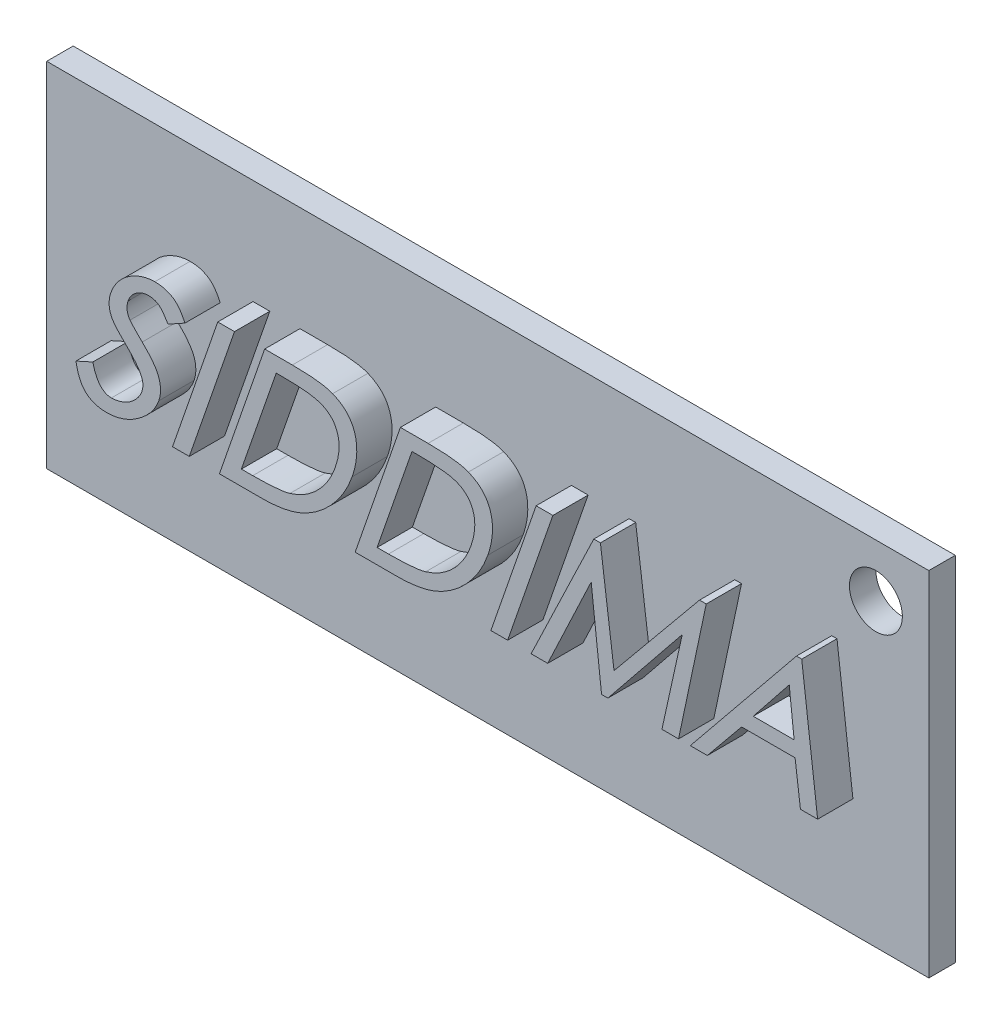
from build123d import *

# Parameters (mm, degrees)
SKETCH1_W           = 50
SKETCH1_H           = 20
BOSS_EXTRUDE1_DEPTH = 1.5
BOSS_EXTRUDE2_DEPTH = 2
SKETCH3_R           = 1.5
CUT_EXTRUDE1_DEPTH  = 2


with BuildPart() as part:
    # Sketch1 → Boss-Extrude1 (new body)
    with BuildSketch(Plane.XY):
        Rectangle(SKETCH1_W, SKETCH1_H)
    extrude(amount=BOSS_EXTRUDE1_DEPTH)

    # Sketch2 → Boss-Extrude2 (add)
    # profile 1 of 7: a face of its own
    with BuildSketch(Plane.XY.offset(1.5)):
        with BuildLine():
            Line((-21.344003625, -1.8865973), (-20.388281136, -1.456225371))
            add(Edge.make_bspline(
                [(-20.388281136, -1.456225371), (-20.362960221, -1.553269663), (-20.315010219, -1.737041615), (-20.2181252, -1.98905157), (-20.109537942, -2.204248298), (-19.984644113, -2.381145398), (-19.843650668, -2.520164124), (-19.685934766, -2.619307815), (-19.512566104, -2.680377571), (-19.39149059, -2.687393616), (-19.330159808, -2.690947593)],
                knots=[0, 0, 0, 0, 1.366242747, 2.587242303, 3.672994386, 4.644237624, 5.526474312, 6.353482186, 7.165956663, 8, 8, 8, 8], degree=3))
            add(Edge.make_bspline(
                [(-19.330159808, -2.690947593), (-19.269679378, -2.688896791), (-19.146954102, -2.684735357), (-18.963491325, -2.652014862), (-18.778607925, -2.601019946), (-18.5952713, -2.530265135), (-18.417917956, -2.442358439), (-18.251645393, -2.339979927), (-18.101743951, -2.222040741), (-17.966739418, -2.093141363), (-17.848042197, -1.95533337), (-17.74749041, -1.812283028), (-17.664733434, -1.664857573), (-17.625286743, -1.562131664), (-17.605704012, -1.511134893)],
                knots=[0, 0, 0, 0, 0.982389124, 1.993437814, 3.019335133, 4.095770719, 5.181531962, 6.23223351, 7.263064189, 8.275167036, 9.261364393, 10.213689592, 11.113212396, 12, 12, 12, 12], degree=3))
            add(Edge.make_bspline(
                [(-17.605704012, -1.511134893), (-17.588822387, -1.454174906), (-17.555676619, -1.342338373), (-17.541493726, -1.168782704), (-17.556739406, -0.995851623), (-17.592154097, -0.885867351), (-17.610156136, -0.829960013)],
                knots=[0, 0, 0, 0, 1.023665939, 2.009888962, 2.98838436, 4, 4, 4, 4], degree=3))
            add(Edge.make_bspline(
                [(-17.610156136, -0.829960013), (-17.627190253, -0.789515308), (-17.663151166, -0.704132041), (-17.735965836, -0.577789844), (-17.822191921, -0.444120161), (-17.923394443, -0.303717262), (-18.042849624, -0.159401469), (-18.176480814, -0.007481312), (-18.327046871, 0.149878904), (-18.434483134, 0.255180883), (-18.490192527, 0.309783577)],
                knots=[0, 0, 0, 0, 0.725921294, 1.53250051, 2.409358469, 3.35948991, 4.395527304, 5.509549822, 6.708616029, 8, 8, 8, 8], degree=3))
            add(Edge.make_bspline(
                [(-18.490192527, 0.309783577), (-18.547483065, 0.364786977), (-18.65701744, 0.469948552), (-18.807211893, 0.626478254), (-18.942474033, 0.768026004), (-19.056107511, 0.901143823), (-19.15502746, 1.019976781), (-19.233576029, 1.128935991), (-19.296600399, 1.224356353), (-19.325836044, 1.287426594), (-19.339064055, 1.315963464)],
                knots=[0, 0, 0, 0, 1.440931207, 2.754931364, 3.936117262, 4.992495269, 5.930372775, 6.740127158, 7.429955742, 8, 8, 8, 8], degree=3))
            add(Edge.make_bspline(
                [(-19.339064055, 1.315963464), (-19.357243675, 1.360167348), (-19.393421677, 1.448134434), (-19.432293262, 1.585861469), (-19.455364776, 1.726757528), (-19.466351213, 1.870323633), (-19.461662588, 2.016559284), (-19.441565107, 2.165377544), (-19.409262346, 2.317394668), (-19.377511539, 2.417850217), (-19.361324672, 2.469063424)],
                knots=[0, 0, 0, 0, 0.969882978, 1.930096936, 2.897689013, 3.864446688, 4.849193057, 5.86201719, 6.910035748, 8, 8, 8, 8], degree=3))
            add(Edge.make_bspline(
                [(-19.361324672, 2.469063424), (-19.330542375, 2.550033224), (-19.268498153, 2.713234432), (-19.14067474, 2.943975632), (-18.987471009, 3.164240416), (-18.810366994, 3.372387411), (-18.610404126, 3.564575431), (-18.392320625, 3.737546616), (-18.15569863, 3.886142644), (-17.906516484, 4.013204466), (-17.649205355, 4.115125741), (-17.389273342, 4.188662823), (-17.130370637, 4.233232066), (-16.957837517, 4.23943009), (-16.872587693, 4.242492578)],
                knots=[0, 0, 0, 0, 0.960482324, 1.935930141, 2.918338052, 3.934950457, 4.964001294, 5.99217285, 7.018862584, 8.06002957, 9.092896566, 10.08544053, 11.054002747, 12, 12, 12, 12], degree=3))
            add(Edge.make_bspline(
                [(-16.872587693, 4.242492578), (-16.778923985, 4.239266036), (-16.597820328, 4.233027349), (-16.335943655, 4.18760811), (-16.097130906, 4.106322496), (-15.912904893, 4.014411447), (-15.777493893, 3.920986078), (-15.679876419, 3.837666417), (-15.585289109, 3.741131858), (-15.494112805, 3.631888796), (-15.40582567, 3.508901125), (-15.321978592, 3.372812811), (-15.241639744, 3.223217783), (-15.191708833, 3.118306658), (-15.165940391, 3.064163918)],
                knots=[0, 0, 0, 0, 1.517209808, 2.933604147, 4.286903352, 5.591513207, 6.253966455, 6.947629261, 7.667329603, 8.441002673, 9.250575696, 10.117904152, 11.028684271, 12, 12, 12, 12], degree=3))
            Line((-15.165940391, 3.064163918), (-16.124630962, 2.532877193))
            add(Edge.make_bspline(
                [(-16.124630962, 2.532877193), (-16.150169089, 2.576022704), (-16.199264268, 2.65896679), (-16.273059013, 2.776900701), (-16.346275621, 2.881305802), (-16.413818889, 2.97658868), (-16.481826628, 3.056994595), (-16.546405757, 3.126639276), (-16.607607665, 3.184731604), (-16.687598195, 3.244394949), (-16.79243621, 3.302339013), (-16.928016068, 3.353887847), (-17.07729463, 3.381257497), (-17.18017933, 3.38549878), (-17.233209688, 3.387684885)],
                knots=[0, 0, 0, 0, 1.215895862, 2.337470802, 3.372356939, 4.308146137, 5.168290878, 5.923677575, 6.611245207, 7.211060785, 8.338969284, 9.504341646, 10.713650776, 12, 12, 12, 12], degree=3))
            add(Edge.make_bspline(
                [(-17.233209688, 3.387684885), (-17.292830958, 3.384715386), (-17.412615845, 3.378749374), (-17.589337972, 3.33343291), (-17.762186049, 3.261597554), (-17.926367733, 3.160435809), (-18.078854909, 3.038196565), (-18.207403288, 2.892260061), (-18.313101208, 2.727948925), (-18.360620546, 2.606574408), (-18.384825607, 2.544749522)],
                knots=[0, 0, 0, 0, 0.941623222, 1.891811974, 2.866273965, 3.890870804, 4.930192469, 5.943899404, 6.952678138, 8, 8, 8, 8], degree=3))
            add(Edge.make_bspline(
                [(-18.384825607, 2.544749522), (-18.39757719, 2.50541204), (-18.42260539, 2.428202303), (-18.44438546, 2.31107468), (-18.453788849, 2.197154974), (-18.4497612, 2.0858588), (-18.429893565, 1.976104714), (-18.395445621, 1.867458916), (-18.345786221, 1.758651091), (-18.302102077, 1.689940519), (-18.279458687, 1.654324843)],
                knots=[0, 0, 0, 0, 1.061690431, 2.083835451, 3.05291063, 3.994329682, 4.936863702, 5.909766272, 6.916541013, 8, 8, 8, 8], degree=3))
            add(Edge.make_bspline(
                [(-18.279458687, 1.654324843), (-18.267282715, 1.637848425), (-18.239667079, 1.600479189), (-18.187667307, 1.540890776), (-18.12237153, 1.468173598), (-18.042982608, 1.382807762), (-17.948413681, 1.28589856), (-17.840547526, 1.176597148), (-17.718783872, 1.054469761), (-17.632040696, 0.970061591), (-17.586411478, 0.925660647)],
                knots=[0, 0, 0, 0, 0.488404034, 1.107721659, 1.884627782, 2.819503016, 3.887381442, 5.113651768, 6.481704013, 8, 8, 8, 8], degree=3))
            add(Edge.make_bspline(
                [(-17.586411478, 0.925660647), (-17.524682994, 0.865206623), (-17.405198606, 0.748189137), (-17.238146073, 0.571997698), (-17.091994044, 0.399476015), (-16.961230971, 0.235091004), (-16.851202553, 0.074865198), (-16.760277124, -0.080016956), (-16.686238151, -0.228240187), (-16.615797665, -0.417170906), (-16.561763446, -0.651595078), (-16.539618852, -0.933403902), (-16.565667867, -1.216017232), (-16.619641068, -1.397059267), (-16.647013441, -1.488874276)],
                knots=[0, 0, 0, 0, 1.126961503, 2.18139661, 3.16540865, 4.075407739, 4.920159245, 5.698125861, 6.416667466, 7.078222902, 8.324060742, 9.540477173, 10.752659238, 12, 12, 12, 12], degree=3))
            add(Edge.make_bspline(
                [(-16.647013441, -1.488874276), (-16.671945598, -1.555226857), (-16.722266715, -1.689147715), (-16.822047906, -1.881161294), (-16.93600829, -2.069746735), (-17.071024242, -2.251265218), (-17.223996011, -2.427648833), (-17.395207574, -2.598638201), (-17.584881103, -2.763179379), (-17.788306172, -2.922458119), (-18.003993394, -3.066948843), (-18.224065806, -3.196405167), (-18.448893797, -3.303133571), (-18.676811721, -3.390699253), (-18.907472543, -3.461804815), (-19.142000929, -3.510358179), (-19.379899053, -3.539132646), (-19.539331812, -3.543538534), (-19.619547829, -3.545755286)],
                knots=[0, 0, 0, 0, 0.888474965, 1.793228361, 2.709591257, 3.650401977, 4.627082336, 5.636340541, 6.683060695, 7.775419217, 8.87524379, 9.937485282, 10.975616154, 11.993234322, 12.998363101, 14.000018463, 14.993741594, 16, 16, 16, 16], degree=3))
            add(Edge.make_bspline(
                [(-19.619547829, -3.545755286), (-19.675972291, -3.544487522), (-19.786587136, -3.54200219), (-19.949062906, -3.526260774), (-20.102825839, -3.496448759), (-20.248457366, -3.455567285), (-20.387115875, -3.406520638), (-20.516354377, -3.341261151), (-20.638812111, -3.267513296), (-20.753099796, -3.180827422), (-20.857824221, -3.078361212), (-20.954909292, -2.960353429), (-21.042881927, -2.824610156), (-21.118825168, -2.669641236), (-21.19111869, -2.499456028), (-21.250586153, -2.310254312), (-21.302834145, -2.104564319), (-21.329955949, -1.960971086), (-21.344003625, -1.8865973)],
                knots=[0, 0, 0, 0, 1.016743274, 1.993229434, 2.937199628, 3.834660296, 4.717258582, 5.582263595, 6.438313194, 7.290455994, 8.16031522, 9.07217833, 10.038851953, 11.067287897, 12.178024352, 13.367542962, 14.636524905, 16, 16, 16, 16], degree=3))
        make_face()
    # profile 2 of 7: a face of its own
    with BuildSketch(Plane.XY.offset(1.5)):
        Polygon((-13.30495281, 4.052535313), (-12.355166486, 4.052535313), (-14.919589563, -3.355798021), (-15.869375887, -3.355798021), align=None)
    # profile 3 of 7: a face of its own
    with BuildSketch(Plane.XY.offset(1.5)):
        with BuildLine():
            Line((-13.209974178, -3.355798021), (-10.645551101, 4.052535313))
            Line((-10.645551101, 4.052535313), (-9.076919624, 4.052535313))
            add(Edge.make_bspline(
                [(-9.076919624, 4.052535313), (-8.945325511, 4.051619075), (-8.692963826, 4.04986198), (-8.329721968, 4.038311188), (-7.997552168, 4.018267723), (-7.696179978, 3.988447048), (-7.42548157, 3.952804315), (-7.186421263, 3.90641972), (-6.977036736, 3.855755949), (-6.851494679, 3.808784872), (-6.792980321, 3.78689195)],
                knots=[0, 0, 0, 0, 1.366832694, 2.621213016, 3.774402572, 4.822495382, 5.766418358, 6.608854307, 7.351595794, 8, 8, 8, 8], degree=3))
            add(Edge.make_bspline(
                [(-6.792980321, 3.78689195), (-6.713478348, 3.75249298), (-6.557992297, 3.685217166), (-6.344332953, 3.55779232), (-6.151639423, 3.415947948), (-5.981076035, 3.256573209), (-5.83418645, 3.078860879), (-5.707273699, 2.886108402), (-5.607110924, 2.674639252), (-5.526791055, 2.448946047), (-5.469447147, 2.209585513), (-5.433983701, 1.959656644), (-5.420946572, 1.699430107), (-5.430176465, 1.429425936), (-5.462333738, 1.149851408), (-5.514464412, 0.860162995), (-5.59011562, 0.560724103), (-5.656418403, 0.360350041), (-5.69033776, 0.257842137)],
                knots=[0, 0, 0, 0, 1.003676702, 1.962941546, 2.877383125, 3.774310335, 4.662332304, 5.545430226, 6.44345751, 7.368828381, 8.319148795, 9.292699156, 10.292219421, 11.336866127, 12.422073384, 13.552960261, 14.748136797, 16, 16, 16, 16], degree=3))
            add(Edge.make_bspline(
                [(-5.69033776, 0.257842137), (-5.722440001, 0.16838992), (-5.786431439, -0.009920869), (-5.900856979, -0.26964819), (-6.024475281, -0.523293961), (-6.161844173, -0.768617466), (-6.310038251, -1.006963069), (-6.47283621, -1.236846423), (-6.645602408, -1.461036648), (-6.831022362, -1.675454941), (-7.024571183, -1.87905344), (-7.223514452, -2.071392798), (-7.428508107, -2.249194555), (-7.638007429, -2.414798978), (-7.853313386, -2.565957432), (-8.073169555, -2.704280964), (-8.297892036, -2.829502986), (-8.529052307, -2.94153267), (-8.770067402, -3.040670429), (-9.024515643, -3.125127374), (-9.293905134, -3.195602046), (-9.577441683, -3.255794191), (-9.876509344, -3.299076083), (-10.189407424, -3.331314642), (-10.517113872, -3.353427486), (-10.740492084, -3.354995582), (-10.854800901, -3.355798021)],
                knots=[0, 0, 0, 0, 1.010405795, 2.014106073, 3.016371507, 4.010207169, 5.002802862, 5.999655357, 7.004581903, 8.011709222, 9.012703657, 9.991216675, 10.953286281, 11.897322833, 12.829959892, 13.749507708, 14.658521497, 15.564378687, 16.479763721, 17.428012392, 18.413121441, 19.439722149, 20.508845144, 21.62488003, 22.784585348, 24, 24, 24, 24], degree=3))
            Line((-10.854800901, -3.355798021), (-13.209974178, -3.355798021))
        make_face()
        with BuildLine():
            Line((-11.964863668, -2.500990328), (-11.320789816, -2.500990328))
            add(Edge.make_bspline(
                [(-11.320789816, -2.500990328), (-11.20156259, -2.500530034), (-10.97197695, -2.499643685), (-10.641028246, -2.489877916), (-10.337069539, -2.478267021), (-10.060094565, -2.456414193), (-9.809952322, -2.43259318), (-9.586235719, -2.401133021), (-9.389083744, -2.366040763), (-9.268186621, -2.333558216), (-9.211967367, -2.318453269)],
                knots=[0, 0, 0, 0, 1.348214872, 2.596141698, 3.744028624, 4.787467021, 5.737634201, 6.584926558, 7.341966374, 8, 8, 8, 8], degree=3))
            add(Edge.make_bspline(
                [(-9.211967367, -2.318453269), (-9.13991281, -2.295634063), (-8.996725367, -2.250287539), (-8.787792461, -2.165844967), (-8.584526219, -2.070255478), (-8.388228338, -1.958976003), (-8.196266469, -1.83771885), (-8.010590439, -1.702700769), (-7.832099473, -1.55295214), (-7.659226648, -1.392412966), (-7.494526102, -1.219724749), (-7.338519716, -1.038472494), (-7.195883487, -0.844981209), (-7.06241576, -0.644288065), (-6.940107503, -0.432890958), (-6.827102145, -0.213135191), (-6.728031347, 0.018177431), (-6.669615364, 0.176452838), (-6.640124085, 0.256358096)],
                knots=[0, 0, 0, 0, 0.959248876, 1.906227699, 2.858564355, 3.80895243, 4.76894115, 5.739980199, 6.721000852, 7.725266485, 8.733588903, 9.749258136, 10.759144028, 11.783359658, 12.80774857, 13.858218944, 14.918722941, 16, 16, 16, 16], degree=3))
            add(Edge.make_bspline(
                [(-6.640124085, 0.256358096), (-6.612308022, 0.339624828), (-6.558140284, 0.501774681), (-6.497315144, 0.744329299), (-6.455559754, 0.977448799), (-6.431315148, 1.201091236), (-6.424424358, 1.415567671), (-6.438001306, 1.620714741), (-6.46856594, 1.816797453), (-6.519105476, 2.002325757), (-6.586946385, 2.176199892), (-6.672375311, 2.336392839), (-6.773336528, 2.48333528), (-6.893686955, 2.614980548), (-7.030597478, 2.732036803), (-7.183594956, 2.835652587), (-7.35420154, 2.923770377), (-7.476590283, 2.969461526), (-7.539453011, 2.992929944)],
                knots=[0, 0, 0, 0, 1.293909046, 2.519699707, 3.682769771, 4.782927729, 5.833526919, 6.842101002, 7.809683692, 8.754431735, 9.671294492, 10.555465364, 11.425384753, 12.292732402, 13.177113795, 14.075221225, 15.011372759, 16, 16, 16, 16], degree=3))
            add(Edge.make_bspline(
                [(-7.539453011, 2.992929944), (-7.593653777, 3.009571253), (-7.710770756, 3.045529782), (-7.904597268, 3.085211792), (-8.127433206, 3.12053176), (-8.379428792, 3.149825439), (-8.660602353, 3.171849037), (-8.970966302, 3.185247988), (-9.310819405, 3.196798567), (-9.547348752, 3.19740946), (-9.670536077, 3.19772762)],
                knots=[0, 0, 0, 0, 0.633116377, 1.368037433, 2.207556767, 3.153541761, 4.201335314, 5.357695887, 6.623856279, 8, 8, 8, 8], degree=3))
            Line((-9.670536077, 3.19772762), (-9.991088962, 3.19772762))
            Line((-9.991088962, 3.19772762), (-11.964863668, -2.500990328))
        make_face(mode=Mode.SUBTRACT)
    # profile 4 of 7: a face of its own
    with BuildSketch(Plane.XY.offset(1.5)):
        with BuildLine():
            Line((-5.516704947, -3.355798021), (-2.95228187, 4.052535313))
            Line((-2.95228187, 4.052535313), (-1.383650393, 4.052535313))
            add(Edge.make_bspline(
                [(-1.383650393, 4.052535313), (-1.25205628, 4.051619075), (-0.999694596, 4.04986198), (-0.636452737, 4.038311188), (-0.304282937, 4.018267723), (-0.002910747, 3.988447048), (0.267787661, 3.952804315), (0.506847968, 3.90641972), (0.716232495, 3.855755949), (0.841774551, 3.808784872), (0.90028891, 3.78689195)],
                knots=[0, 0, 0, 0, 1.366832694, 2.621213016, 3.774402572, 4.822495382, 5.766418358, 6.608854307, 7.351595794, 8, 8, 8, 8], degree=3))
            add(Edge.make_bspline(
                [(0.90028891, 3.78689195), (0.979790883, 3.75249298), (1.135276934, 3.685217166), (1.348936277, 3.55779232), (1.541629808, 3.415947948), (1.712193196, 3.256573209), (1.859082781, 3.078860879), (1.985995532, 2.886108402), (2.086158307, 2.674639252), (2.166478176, 2.448946047), (2.223822084, 2.209585513), (2.25928553, 1.959656644), (2.272322659, 1.699430107), (2.263092765, 1.429425936), (2.230935493, 1.149851408), (2.178804819, 0.860162995), (2.103153611, 0.560724103), (2.036850828, 0.360350041), (2.002931471, 0.257842137)],
                knots=[0, 0, 0, 0, 1.003676702, 1.962941546, 2.877383125, 3.774310335, 4.662332304, 5.545430226, 6.44345751, 7.368828381, 8.319148795, 9.292699156, 10.292219421, 11.336866127, 12.422073384, 13.552960261, 14.748136797, 16, 16, 16, 16], degree=3))
            add(Edge.make_bspline(
                [(2.002931471, 0.257842137), (1.97082923, 0.16838992), (1.906837792, -0.009920869), (1.792412252, -0.26964819), (1.66879395, -0.523293961), (1.531425058, -0.768617466), (1.383230979, -1.006963069), (1.22043302, -1.236846423), (1.047666823, -1.461036648), (0.862246869, -1.675454941), (0.668698048, -1.87905344), (0.469754779, -2.071392798), (0.264761124, -2.249194555), (0.055261802, -2.414798978), (-0.160044155, -2.565957432), (-0.379900324, -2.704280964), (-0.604622806, -2.829502986), (-0.835783076, -2.94153267), (-1.076798171, -3.040670429), (-1.331246412, -3.125127374), (-1.600635903, -3.195602046), (-1.884172453, -3.255794191), (-2.183240113, -3.299076083), (-2.496138193, -3.331314642), (-2.823844641, -3.353427486), (-3.047222854, -3.354995582), (-3.16153167, -3.355798021)],
                knots=[0, 0, 0, 0, 1.010405795, 2.014106073, 3.016371507, 4.010207169, 5.002802862, 5.999655357, 7.004581903, 8.011709222, 9.012703657, 9.991216675, 10.953286281, 11.897322833, 12.829959892, 13.749507708, 14.658521497, 15.564378687, 16.479763721, 17.428012392, 18.413121441, 19.439722149, 20.508845144, 21.62488003, 22.784585348, 24, 24, 24, 24], degree=3))
            Line((-3.16153167, -3.355798021), (-5.516704947, -3.355798021))
        make_face()
        with BuildLine():
            Line((-4.271594437, -2.500990328), (-3.627520586, -2.500990328))
            add(Edge.make_bspline(
                [(-3.627520586, -2.500990328), (-3.508293359, -2.500530034), (-3.278707719, -2.499643685), (-2.947759015, -2.489877916), (-2.643800308, -2.478267021), (-2.366825334, -2.456414193), (-2.116683091, -2.43259318), (-1.892966488, -2.401133021), (-1.695814513, -2.366040763), (-1.57491739, -2.333558216), (-1.518698136, -2.318453269)],
                knots=[0, 0, 0, 0, 1.348214872, 2.596141698, 3.744028624, 4.787467021, 5.737634201, 6.584926558, 7.341966374, 8, 8, 8, 8], degree=3))
            add(Edge.make_bspline(
                [(-1.518698136, -2.318453269), (-1.446643579, -2.295634063), (-1.303456136, -2.250287539), (-1.09452323, -2.165844967), (-0.891256988, -2.070255478), (-0.694959107, -1.958976003), (-0.502997239, -1.83771885), (-0.317321209, -1.702700769), (-0.138830243, -1.55295214), (0.034042582, -1.392412966), (0.198743129, -1.219724749), (0.354749515, -1.038472494), (0.497385744, -0.844981209), (0.630853471, -0.644288065), (0.753161727, -0.432890958), (0.866167086, -0.213135191), (0.965237884, 0.018177431), (1.023653867, 0.176452838), (1.053145146, 0.256358096)],
                knots=[0, 0, 0, 0, 0.959248876, 1.906227699, 2.858564355, 3.80895243, 4.76894115, 5.739980199, 6.721000852, 7.725266485, 8.733588903, 9.749258136, 10.759144028, 11.783359658, 12.80774857, 13.858218944, 14.918722941, 16, 16, 16, 16], degree=3))
            add(Edge.make_bspline(
                [(1.053145146, 0.256358096), (1.080961209, 0.339624828), (1.135128946, 0.501774681), (1.195954087, 0.744329299), (1.237709477, 0.977448799), (1.261954083, 1.201091236), (1.268844872, 1.415567671), (1.255267925, 1.620714741), (1.224703291, 1.816797453), (1.174163755, 2.002325757), (1.106322846, 2.176199892), (1.02089392, 2.336392839), (0.919932703, 2.48333528), (0.799582275, 2.614980548), (0.662671752, 2.732036803), (0.509674275, 2.835652587), (0.339067691, 2.923770377), (0.216678948, 2.969461526), (0.15381622, 2.992929944)],
                knots=[0, 0, 0, 0, 1.293909046, 2.519699707, 3.682769771, 4.782927729, 5.833526919, 6.842101002, 7.809683692, 8.754431735, 9.671294492, 10.555465364, 11.425384753, 12.292732402, 13.177113795, 14.075221225, 15.011372759, 16, 16, 16, 16], degree=3))
            add(Edge.make_bspline(
                [(0.15381622, 2.992929944), (0.099615453, 3.009571253), (-0.017501525, 3.045529782), (-0.211328037, 3.085211792), (-0.434163975, 3.12053176), (-0.686159561, 3.149825439), (-0.967333122, 3.171849037), (-1.277697071, 3.185247988), (-1.617550175, 3.196798567), (-1.854079521, 3.19740946), (-1.977266846, 3.19772762)],
                knots=[0, 0, 0, 0, 0.633116377, 1.368037433, 2.207556767, 3.153541761, 4.201335314, 5.357695887, 6.623856279, 8, 8, 8, 8], degree=3))
            Line((-1.977266846, 3.19772762), (-2.297819731, 3.19772762))
            Line((-2.297819731, 3.19772762), (-4.271594437, -2.500990328))
        make_face(mode=Mode.SUBTRACT)
    # profile 5 of 7: a face of its own
    with BuildSketch(Plane.XY.offset(1.5)):
        Polygon((4.74098736, 4.052535313), (5.690773685, 4.052535313), (3.126350608, -3.355798021), (2.176564284, -3.355798021), align=None)
    # profile 6 of 7: a face of its own
    with BuildSketch(Plane.XY.offset(1.5)):
        Polygon((4.456051463, -3.355798021), (8.010329975, 4.052535313), (8.384308341, 4.052535313), (9.15600973, -1.836139901), (14.002888068, 4.052535313), (14.382802598, 4.052535313), (12.814171121, -3.355798021), (11.871805002, -3.355798021), (13.02193688, 1.868026766), (8.808744105, -3.355798021), (8.449606151, -3.355798021), (7.861925862, 1.868026766), (5.396933541, -3.355798021), align=None)
    # profile 7 of 7: a face of its own
    with BuildSketch(Plane.XY.offset(1.5)):
        Polygon((19.795100608, 4.052535313), (20.697397617, -3.355798021), (19.722382593, -3.355798021), (19.419638202, -0.981332209), (16.389226209, -0.981332209), (14.442164243, -3.355798021), (13.479021548, -3.355798021), (19.498292382, 4.052535313), align=None)
        Polygon((19.087212988, 2.433446437), (17.046656431, -0.126524516), (19.36472868, -0.126524516), align=None, mode=Mode.SUBTRACT)
    extrude(amount=BOSS_EXTRUDE2_DEPTH)

    # Sketch3 → Cut-Extrude1 (cut)
    with BuildSketch(Plane.XY.offset(1.5)):
        with Locations((22, 7)):
            Circle(SKETCH3_R)
    extrude(amount=-CUT_EXTRUDE1_DEPTH, mode=Mode.SUBTRACT)


solid = part.part
